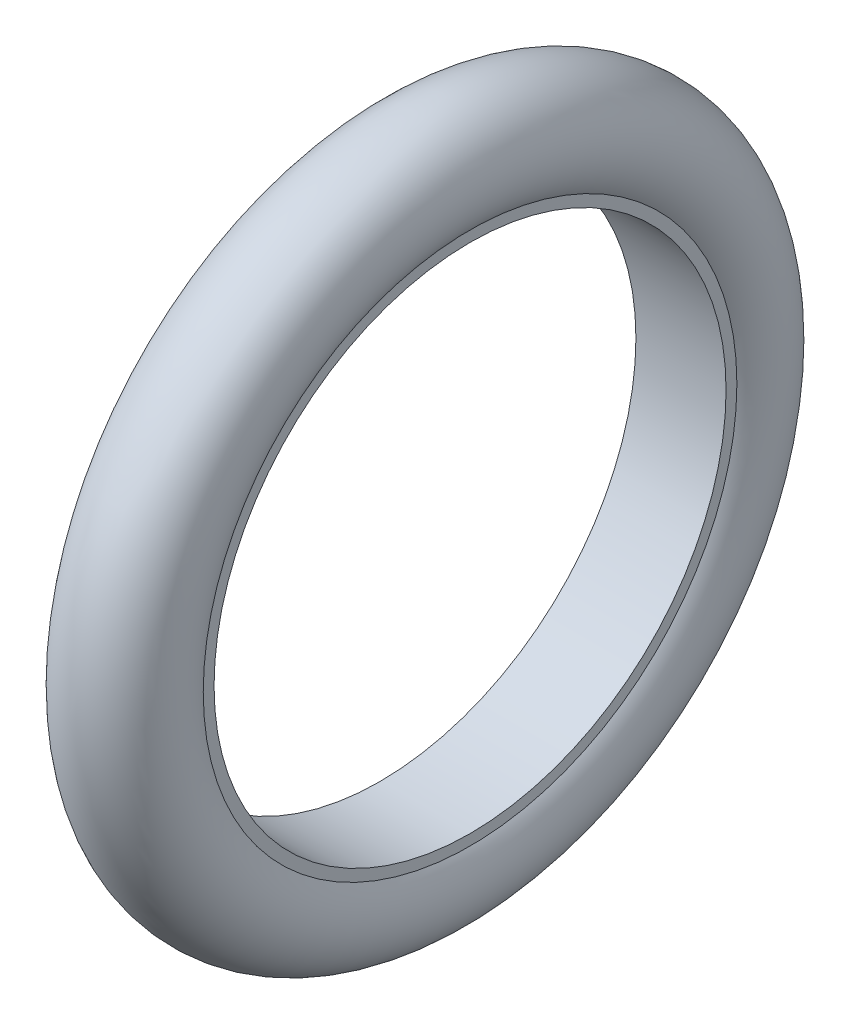
from build123d import *


with BuildPart() as part:
    # Sketch1 → Revolve1 (revolve)
    with BuildSketch(Plane.XY, mode=Mode.PRIVATE) as revolve1_sk:
        with BuildLine():
            Line((-12.5, 74), (-12.5, 71))
            Line((-12.5, 71), (12.5, 71))
            Line((12.5, 71), (12.5, 74))
            ThreePointArc((12.5, 74), (0, 98.66515139), (-12.5, 74))
        make_face()
    revolve(revolve1_sk.sketch.rotate(Axis((-32.630489018, 0, 0), (1, 0, 0)), 90), axis=Axis((-32.630489018, 0, 0), (1, 0, 0)))


solid = part.part
